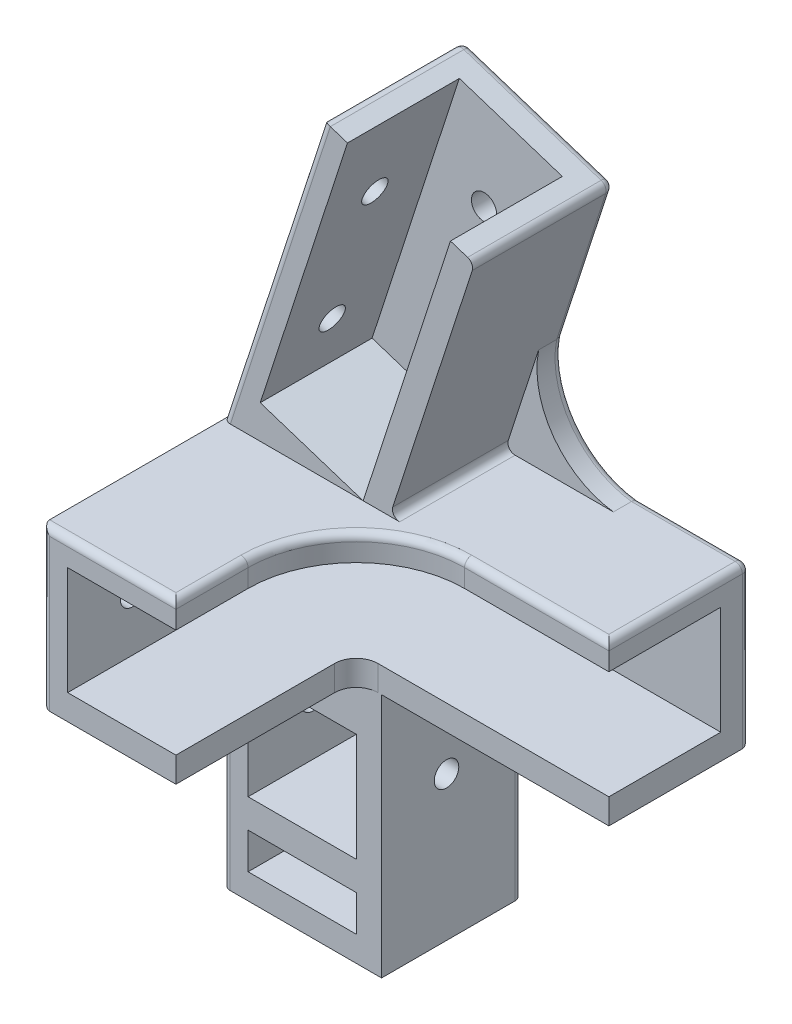
from build123d import *

# Parameters (mm, degrees)
BOSS_EXTRUDE1_DEPTH  = 19.5
SKETCH3_W            = 18.5
SKETCH3_H            = 22
BOSS_EXTRUDE2_DEPTH  = 25
SKETCH5_W            = 50
SKETCH5_H            = 15
SKETCH5_W_2          = 15
SKETCH5_H_2          = 5
CUT_EXTRUDE1_DEPTH   = 40.5
BOSS_EXTRUDE4_DEPTH  = 3.5
BOSS_EXTRUDE5_DEPTH  = 3.5
BOSS_EXTRUDE6_DEPTH  = 3.5
FILLET3_R            = 3
CUT_EXTRUDE3_DEPTH   = 1
SKETCH12_R           = 1.7
CUT_EXTRUDE4_DEPTH   = 5
SKETCH13_R           = 1.7
CUT_EXTRUDE5_DEPTH   = 45
SKETCH14_R           = 1.7
CUT_EXTRUDE6_DEPTH   = 45
SKETCH15_R           = 1.7
CUT_EXTRUDE7_DEPTH   = 4
FILLET3_OF_MIRROR2_R = 3
SKETCH16_W           = 70.294928241
SKETCH16_H           = 57.866283398
CUT_EXTRUDE8_DEPTH   = 72
BOSS_EXTRUDE7_DEPTH  = 19.5
CUT_EXTRUDE10_DEPTH  = 15.5
BOSS_EXTRUDE8_DEPTH  = 3.5
FILLET4_R            = 1
FILLET5_R            = 1
SKETCH24_R           = 1.75
CUT_EXTRUDE11_DEPTH  = 10
SKETCH25_R           = 1.75
CUT_EXTRUDE12_DEPTH  = 10


with BuildPart() as part:
    # Sketch1 → Boss-Extrude1 (new body)
    with BuildSketch(Plane.XY):
        Polygon((-5.699410772, 32.916253451), (16.300589228, 32.916253451), (16.300589228, -23.083746549), (-5.699410772, -23.083746549), (-5.699410772, 10.916253451), (-37.199410772, 10.916253451), (-37.199410772, 32.916253451), align=None)
    boss_extrude1 = extrude(amount=BOSS_EXTRUDE1_DEPTH)

    # Sketch3 → Boss-Extrude2 (add)
    with BuildSketch(Plane.XY.offset(19.5)):
        with Locations((7.050589228, 21.916253451)):
            Rectangle(SKETCH3_W, SKETCH3_H)
    boss_extrude2 = extrude(amount=BOSS_EXTRUDE2_DEPTH)

    # Sketch5 → Cut-Extrude1 (cut)
    with BuildSketch(Plane.XY.offset(44.5)):
        with Locations((-12.199410772, 21.916253451)):
            Rectangle(SKETCH5_W, SKETCH5_H)
        with Locations((5.300589228, -3.083746549)):
            Rectangle(SKETCH5_W_2, SKETCH5_H)
        with Locations((5.300589228, -17.083746549)):
            Rectangle(SKETCH5_W_2, SKETCH5_H_2)
    cut_extrude1 = extrude(amount=-CUT_EXTRUDE1_DEPTH, mode=Mode.SUBTRACT)

    # Sketch7 → Boss-Extrude4 (add)
    with BuildSketch(Plane(origin=(16.300589228, 0, 0), x_dir=(0, 0, -1), z_dir=(1, 0, 0))):
        with BuildLine():
            Line((-34.5, 10.916253451), (-19.5, 10.916253451))
            Line((-19.5, 10.916253451), (-19.5, -4.083746549))
            ThreePointArc((-19.5, -4.083746549), (-23.893398282, 6.522855169), (-34.5, 10.916253451))
        make_face()
    boss_extrude4 = extrude(amount=-BOSS_EXTRUDE4_DEPTH)

    # Sketch8 → Boss-Extrude5 (add)
    with BuildSketch(Plane(origin=(0, 0, 0), x_dir=(-1, 0, 0), z_dir=(0, 0, -1))):
        with BuildLine():
            Line((5.699410772, 10.916253451), (20.699410772, 10.916253451))
            ThreePointArc((20.699410772, 10.916253451), (10.092809055, 6.522855169), (5.699410772, -4.083746549))
            Line((5.699410772, -4.083746549), (5.699410772, 10.916253451))
        make_face()
    boss_extrude5 = extrude(amount=-BOSS_EXTRUDE5_DEPTH)

    # Sketch9 → Boss-Extrude6 (add)
    with BuildSketch(Plane(origin=(0, 32.916253451, 0), x_dir=(1, 0, 0), z_dir=(0, 1, 0))):
        with BuildLine():
            Line((-2.199410772, -34.5), (-2.199410772, -19.5))
            Line((-2.199410772, -19.5), (-17.199410772, -19.5))
            ThreePointArc((-17.199410772, -19.5), (-6.592809055, -23.893398282), (-2.199410772, -34.5))
        make_face()
    boss_extrude6 = extrude(amount=-BOSS_EXTRUDE6_DEPTH)

    # Fillet3
    fillet3_edges = [part.edges().sort_by_distance(p)[0] for p in [
        (-2.199410772, 12.666253451, 19.5),
    ]]
    fillet(fillet3_edges, radius=FILLET3_R)

    # Sketch11 → Cut-Extrude3 (cut)
    # profile 1 of 4: a face of its own
    with BuildSketch(Plane(origin=(0, 0, 0), x_dir=(-1, 0, 0), z_dir=(0, 0, -1))):
        Polygon((-10.800589228, -18.789996549), (-10.800589228, -16.838073472), (-2.43039692, -14.652977318), (-10.800589228, -12.463073472), (-10.800589228, -10.515958087), (1.199410772, -8.729900395), (1.199410772, -10.602496549), (-6.379916151, -11.729900395), (1.199410772, -13.715477318), (1.199410772, -15.597688857), (-6.379916151, -17.576054241), (1.199410772, -18.703458087), (1.199410772, -20.576054241), align=None)
    # profile 2 of 4: a face of its own
    with BuildSketch(Plane(origin=(0, 0, 0), x_dir=(-1, 0, 0), z_dir=(0, 0, -1))):
        with BuildLine():
            Line((-10.800589228, -7.991438857), (-10.800589228, -5.952977318))
            add(Edge.make_bspline(
                [(-10.800589228, -5.952977318), (-10.800005012, -5.818337024), (-10.798881276, -5.559357226), (-10.780939362, -5.185841664), (-10.756194453, -4.841644627), (-10.717588986, -4.528141475), (-10.670910939, -4.244422827), (-10.610297955, -3.991812577), (-10.542991354, -3.767135176), (-10.432899575, -3.510089545), (-10.261344606, -3.2204116), (-9.993854575, -2.916502166), (-9.674999978, -2.642644015), (-9.298421338, -2.412342144), (-8.876833149, -2.221736808), (-8.412796045, -2.089022583), (-7.914245505, -2.00467731), (-7.569376461, -1.995936272), (-7.391935381, -1.991438857)],
                knots=[0, 0, 0, 0, 1.067446855, 2.053227611, 2.964447842, 3.802928181, 4.55705831, 5.242813606, 5.861740442, 6.41401137, 7.456762865, 8.515266784, 9.610284097, 10.777391769, 12.003071174, 13.267653188, 14.594160368, 16, 16, 16, 16], degree=3))
            add(Edge.make_bspline(
                [(-7.391935381, -1.991438857), (-7.297355032, -1.992855248), (-7.111944506, -1.99563187), (-6.839545611, -2.016474255), (-6.57922187, -2.056818659), (-6.329385024, -2.104637483), (-6.092864844, -2.173393793), (-5.86736032, -2.254741183), (-5.654862929, -2.353204183), (-5.453365078, -2.465039747), (-5.262464902, -2.588608019), (-5.086843378, -2.732896484), (-4.9205107, -2.888692529), (-4.766123648, -3.059365613), (-4.626046251, -3.246963608), (-4.496602326, -3.448494847), (-4.377999142, -3.665222723), (-4.310704173, -3.817832702), (-4.276550766, -3.895285011)],
                knots=[0, 0, 0, 0, 1.163181294, 2.28024169, 3.356120165, 4.401649984, 5.406013808, 6.381787017, 7.347406326, 8.282525473, 9.21452408, 10.139462981, 11.073595085, 12.01554303, 12.965498088, 13.949545959, 14.959357709, 16, 16, 16, 16], degree=3))
            Line((-4.276550766, -3.895285011), (1.199410772, -1.452977318))
            Line((1.199410772, -1.452977318), (1.199410772, -3.541919626))
            Line((1.199410772, -3.541919626), (-4.031358458, -5.873650395))
            Line((-4.031358458, -5.873650395), (-4.031358458, -6.145285011))
            Line((-4.031358458, -6.145285011), (1.199410772, -6.145285011))
            Line((1.199410772, -6.145285011), (1.199410772, -7.991438857))
            Line((1.199410772, -7.991438857), (-10.800589228, -7.991438857))
        make_face()
        with BuildLine():
            Line((-6.185204612, -6.145285011), (-6.185204612, -5.515477318))
            add(Edge.make_bspline(
                [(-6.185204612, -5.515477318), (-6.186367141, -5.438550003), (-6.188596807, -5.291007573), (-6.198784481, -5.078941418), (-6.223636793, -4.886497292), (-6.255016899, -4.712471663), (-6.291026717, -4.555276318), (-6.342625913, -4.418389599), (-6.399049431, -4.298462814), (-6.489896288, -4.166118437), (-6.633796999, -4.027471922), (-6.856716063, -3.91397639), (-7.124487444, -3.84724369), (-7.317795964, -3.840947182), (-7.420781535, -3.837592703)],
                knots=[0, 0, 0, 0, 1.14443165, 2.194958024, 3.155864406, 4.02787753, 4.825710302, 5.549708663, 6.200008757, 6.791751392, 7.929772656, 9.129352395, 10.470655706, 12, 12, 12, 12], degree=3))
            add(Edge.make_bspline(
                [(-7.420781535, -3.837592703), (-7.484265153, -3.839856392), (-7.607360624, -3.844245712), (-7.785755229, -3.879686188), (-7.952879051, -3.933201989), (-8.103735349, -4.014031264), (-8.239800846, -4.109799367), (-8.356212547, -4.223260262), (-8.450592564, -4.353040951), (-8.531146795, -4.502587927), (-8.586059735, -4.694350085), (-8.620716321, -4.939833657), (-8.644326337, -5.246603017), (-8.645891807, -5.472154526), (-8.646743074, -5.594804241)],
                knots=[0, 0, 0, 0, 0.9241003, 1.791841178, 2.640927318, 3.471185814, 4.274581995, 5.058835706, 5.827024317, 6.605084504, 7.520888769, 8.714677486, 10.213517293, 12, 12, 12, 12], degree=3))
            Line((-8.646743074, -5.594804241), (-8.646743074, -6.145285011))
            Line((-8.646743074, -6.145285011), (-6.185204612, -6.145285011))
        make_face(mode=Mode.SUBTRACT)
    # profile 3 of 4: a face of its own
    with BuildSketch(Plane(origin=(0, 0, 0), x_dir=(-1, 0, 0), z_dir=(0, 0, -1))):
        with BuildLine():
            add(Edge.make_bspline(
                [(-1.262127689, -0.176054241), (-1.257647984, -0.104101941), (-1.248753835, 0.038754448), (-1.172545764, 0.242235867), (-1.05033496, 0.427832621), (-0.88404186, 0.590235666), (-0.687299125, 0.730105266), (-0.462023761, 0.828247267), (-0.217504351, 0.891566147), (-0.046993635, 0.897708021), (0.040756926, 0.900868836)],
                knots=[0, 0, 0, 0, 0.919349048, 1.825304879, 2.744940427, 3.746623331, 4.786044724, 5.819977252, 6.878086821, 8, 8, 8, 8], degree=3))
            add(Edge.make_bspline(
                [(0.040756926, 0.900868836), (0.128481887, 0.897613897), (0.299721778, 0.891260229), (0.545324854, 0.828809783), (0.771582895, 0.729449747), (0.970335119, 0.590396057), (1.138671939, 0.427821465), (1.264004419, 0.242957175), (1.339760461, 0.038678283), (1.348736151, -0.104127453), (1.353256926, -0.176054241)],
                knots=[0, 0, 0, 0, 1.117536417, 2.181440851, 3.211339843, 4.255104211, 5.260135653, 6.181815925, 7.084237479, 8, 8, 8, 8], degree=3))
            add(Edge.make_bspline(
                [(1.353256926, -0.176054241), (1.348770157, -0.248001687), (1.339861983, -0.390848436), (1.263364391, -0.595455675), (1.139460356, -0.781986068), (0.970956709, -0.945114294), (0.77080448, -1.081189928), (0.54542444, -1.181069939), (0.299695058, -1.243328016), (0.128472836, -1.249708594), (0.040756926, -1.252977318)],
                knots=[0, 0, 0, 0, 0.915447906, 1.817559426, 2.747445231, 3.752131388, 4.789763433, 5.819308596, 6.882847519, 8, 8, 8, 8], degree=3))
            add(Edge.make_bspline(
                [(0.040756926, -1.252977318), (-0.046984438, -1.249802679), (-0.217477284, -1.243633944), (-0.462123928, -1.180506316), (-0.686511891, -1.081845741), (-0.884668075, -0.944947749), (-1.051117925, -0.781983335), (-1.171904853, -0.594743665), (-1.248854997, -0.390923093), (-1.257681869, -0.248026694), (-1.262127689, -0.176054241)],
                knots=[0, 0, 0, 0, 1.121525552, 2.179269538, 3.212844836, 4.246063491, 5.247400307, 6.175325774, 7.080968592, 8, 8, 8, 8], degree=3))
        make_face()
    # profile 4 of 4: a face of its own
    with BuildSketch(Plane(origin=(0, 0, 0), x_dir=(-1, 0, 0), z_dir=(0, 0, -1))):
        with BuildLine():
            Line((-7.877512305, 3.639330374), (-7.877512305, 1.793176528))
            add(Edge.make_bspline(
                [(-7.877512305, 1.793176528), (-7.985104597, 1.806156245), (-8.194919789, 1.831467926), (-8.50062502, 1.89307865), (-8.789725475, 1.969009097), (-9.063857289, 2.060670567), (-9.32041803, 2.168002956), (-9.560895844, 2.292709709), (-9.787587098, 2.42930416), (-9.925017131, 2.537709574), (-9.99289692, 2.591253451)],
                knots=[0, 0, 0, 0, 1.13409845, 2.211599726, 3.261451197, 4.261463951, 5.235132031, 6.169264622, 7.095758548, 8, 8, 8, 8], degree=3))
            add(Edge.make_bspline(
                [(-9.99289692, 2.591253451), (-10.082013161, 2.667910273), (-10.256359415, 2.817881026), (-10.483761061, 3.07110519), (-10.676767562, 3.337669411), (-10.835123876, 3.619879277), (-10.958228421, 3.915924445), (-11.044683072, 4.227572925), (-11.099664631, 4.553240287), (-11.10537913, 4.776126179), (-11.108281535, 4.889330374)],
                knots=[0, 0, 0, 0, 1.065406432, 2.084352066, 3.078868942, 4.045367136, 5.013203651, 5.979674514, 6.9738726, 8, 8, 8, 8], degree=3))
            add(Edge.make_bspline(
                [(-11.108281535, 4.889330374), (-11.105554752, 4.990429502), (-11.100204953, 5.188780494), (-11.056686246, 5.480236578), (-10.97985421, 5.757907044), (-10.8818086, 6.026068289), (-10.745230943, 6.277428113), (-10.587175591, 6.520140361), (-10.396186865, 6.748620977), (-10.177194209, 6.959885993), (-9.943110555, 7.156839202), (-9.690759412, 7.324416021), (-9.43059281, 7.47074821), (-9.157422302, 7.588703888), (-8.873189212, 7.680392593), (-8.578388089, 7.744054748), (-8.273858918, 7.787935844), (-8.06677444, 7.791411893), (-7.96164692, 7.793176528)],
                knots=[0, 0, 0, 0, 1.018635126, 1.998506719, 2.96030997, 3.918683232, 4.868719089, 5.836268132, 6.834011598, 7.861887245, 8.899958098, 9.91230014, 10.909978245, 11.904579616, 12.905650751, 13.91466998, 14.941371293, 16, 16, 16, 16], degree=3))
            add(Edge.make_bspline(
                [(-7.96164692, 7.793176528), (-7.831571704, 7.7882504), (-7.575267724, 7.778543815), (-7.199658116, 7.710806724), (-6.842854452, 7.593710225), (-6.50564623, 7.43251906), (-6.191993909, 7.228071619), (-5.907939838, 6.979968911), (-5.654954295, 6.689672154), (-5.517272776, 6.469896674), (-5.447223843, 6.358080374)],
                knots=[0, 0, 0, 0, 1.027701034, 2.025011931, 3.004147813, 3.986880317, 4.970346872, 5.953160964, 6.958619193, 8, 8, 8, 8], degree=3))
            add(Edge.make_bspline(
                [(-5.447223843, 6.358080374), (-5.418934484, 6.430798423), (-5.362819656, 6.575042087), (-5.255412748, 6.779194324), (-5.134751997, 6.973329501), (-4.999067172, 7.154540458), (-4.847347238, 7.322970358), (-4.681616094, 7.478791827), (-4.500395305, 7.624150933), (-4.30375287, 7.755244697), (-4.095176448, 7.873355347), (-3.875726079, 7.97347104), (-3.648685489, 8.060719415), (-3.412791492, 8.133216192), (-3.166864793, 8.188590605), (-2.911254324, 8.225884056), (-2.647259211, 8.251365722), (-2.468118928, 8.253589988), (-2.377512305, 8.254714989)],
                knots=[0, 0, 0, 0, 0.971157749, 1.926390409, 2.867917292, 3.816032967, 4.741824403, 5.6878893, 6.646452846, 7.631864642, 8.628382992, 9.628642509, 10.633224323, 11.656081692, 12.699617594, 13.76949873, 14.871843985, 16, 16, 16, 16], degree=3))
            add(Edge.make_bspline(
                [(-2.377512305, 8.254714989), (-2.244325252, 8.252503818), (-1.981850533, 8.248146212), (-1.597044081, 8.197009582), (-1.226862615, 8.122689872), (-0.874542963, 8.009706698), (-0.536107314, 7.870492658), (-0.212201339, 7.699845341), (0.092892066, 7.493753909), (0.380575775, 7.261849568), (0.643411265, 7.006428676), (0.8765742, 6.732895346), (1.069672671, 6.437585756), (1.23223783, 6.128720843), (1.355158488, 5.799574581), (1.443839147, 5.455657192), (1.498563993, 5.093806224), (1.504216675, 4.847057422), (1.50710308, 4.721061143)],
                knots=[0, 0, 0, 0, 1.08934669, 2.146800001, 3.171892192, 4.175766193, 5.1695646, 6.164076811, 7.166278581, 8.178196077, 9.184573215, 10.16196427, 11.113242845, 12.066531174, 13.012937118, 13.981620827, 14.969363733, 16, 16, 16, 16], degree=3))
            add(Edge.make_bspline(
                [(1.50710308, 4.721061143), (1.504031919, 4.602279119), (1.498005885, 4.36921268), (1.44571629, 4.02762683), (1.362713421, 3.702437153), (1.243881772, 3.394298005), (1.091092441, 3.104692046), (0.906771997, 2.829859086), (0.687442467, 2.57259779), (0.434322499, 2.3350891), (0.15282569, 2.119255522), (-0.153407037, 1.926340908), (-0.483775783, 1.75924538), (-0.840338868, 1.624378739), (-1.217591782, 1.506817115), (-1.621739126, 1.421885121), (-2.049128635, 1.361769677), (-2.342880764, 1.341824077), (-2.49289692, 1.331638066)],
                knots=[0, 0, 0, 0, 0.974003266, 1.911126485, 2.827923683, 3.722775623, 4.613731572, 5.50894563, 6.432318302, 7.38099101, 8.351349308, 9.338047726, 10.346428225, 11.382873954, 12.462111462, 13.585146545, 14.766759469, 16, 16, 16, 16], degree=3))
            Line((-2.49289692, 1.331638066), (-2.49289692, 3.177791913))
            add(Edge.make_bspline(
                [(-2.49289692, 3.177791913), (-2.417425318, 3.188945376), (-2.270574462, 3.210647521), (-2.058705359, 3.256683558), (-1.861732034, 3.311165199), (-1.680044741, 3.376135049), (-1.514279405, 3.45120486), (-1.360798784, 3.532148117), (-1.223710633, 3.625749249), (-1.065384613, 3.762941693), (-0.896220111, 3.953356149), (-0.749458771, 4.217045491), (-0.662515335, 4.51137642), (-0.652102457, 4.7164657), (-0.646743074, 4.822022682)],
                knots=[0, 0, 0, 0, 1.004083628, 1.953722164, 2.852062002, 3.692886634, 4.490800013, 5.245942238, 5.974461452, 6.670088602, 8.000762069, 9.303976857, 10.612389357, 12, 12, 12, 12], degree=3))
            add(Edge.make_bspline(
                [(-0.646743074, 4.822022682), (-0.647864371, 4.878202331), (-0.650053976, 4.987906785), (-0.675076379, 5.149181645), (-0.716357012, 5.302683497), (-0.770574005, 5.45033855), (-0.844338553, 5.58810378), (-0.931901508, 5.719433893), (-1.034609515, 5.844770146), (-1.195110626, 5.995917646), (-1.416786421, 6.163242766), (-1.719322479, 6.30573827), (-2.050588673, 6.3928176), (-2.280814454, 6.403216349), (-2.39914692, 6.408561143)],
                knots=[0, 0, 0, 0, 0.766703657, 1.497175717, 2.221804895, 2.935192376, 3.640052165, 4.350243223, 5.088623085, 5.847082799, 7.357237736, 8.859920549, 10.386048059, 12, 12, 12, 12], degree=3))
            add(Edge.make_bspline(
                [(-2.39914692, 6.408561143), (-2.464945748, 6.406711942), (-2.594787133, 6.403062896), (-2.786195597, 6.374088866), (-2.969648465, 6.322755274), (-3.145763747, 6.253440485), (-3.312932079, 6.163011753), (-3.473227413, 6.054384045), (-3.62413007, 5.923172242), (-3.768170684, 5.775714059), (-3.898710135, 5.608114668), (-4.014720541, 5.423570124), (-4.109640596, 5.219059789), (-4.193220285, 4.999736952), (-4.254214347, 4.760765565), (-4.29872396, 4.505093902), (-4.332010414, 4.232310528), (-4.336655471, 4.044084373), (-4.339050766, 3.947022682)],
                knots=[0, 0, 0, 0, 0.899536996, 1.775063972, 2.638995881, 3.499655969, 4.357521698, 5.232774386, 6.141935922, 7.087285127, 8.047315231, 9.041502366, 10.060909586, 11.125312509, 12.246833879, 13.426779274, 14.673079445, 16, 16, 16, 16], degree=3))
            Line((-4.339050766, 3.947022682), (-6.339050766, 3.947022682))
            add(Edge.make_bspline(
                [(-6.339050766, 3.947022682), (-6.351211097, 4.070597942), (-6.374042407, 4.302613426), (-6.427589871, 4.624478183), (-6.497441604, 4.896812425), (-6.588065699, 5.121571579), (-6.694964612, 5.310796304), (-6.816990742, 5.474794656), (-6.9584857, 5.616776513), (-7.116669669, 5.733391795), (-7.285211073, 5.826558536), (-7.45907096, 5.899690982), (-7.641166228, 5.937102036), (-7.763594277, 5.943722311), (-7.824627689, 5.947022682)],
                knots=[0, 0, 0, 0, 1.613490305, 3.029366345, 4.236845818, 5.259854129, 6.169213254, 7.054399038, 7.908596932, 8.76463379, 9.599115534, 10.407455461, 11.206077139, 12, 12, 12, 12], degree=3))
            add(Edge.make_bspline(
                [(-7.824627689, 5.947022682), (-7.902708499, 5.94339984), (-8.054533682, 5.93635536), (-8.271474473, 5.879601033), (-8.4685132, 5.787571995), (-8.638517306, 5.657006158), (-8.780104567, 5.497937744), (-8.882578523, 5.311699797), (-8.945232074, 5.101614866), (-8.951293618, 4.953882443), (-8.954435381, 4.877311143)],
                knots=[0, 0, 0, 0, 1.073009827, 2.08642706, 3.062829201, 4.046239177, 5.014892964, 5.972187552, 6.948963055, 8, 8, 8, 8], degree=3))
            add(Edge.make_bspline(
                [(-8.954435381, 4.877311143), (-8.95071032, 4.808009077), (-8.94335375, 4.671145417), (-8.884755184, 4.47123759), (-8.789639268, 4.281474968), (-8.656940841, 4.105904867), (-8.497545942, 3.947245812), (-8.310497414, 3.816432348), (-8.104113715, 3.708690565), (-7.953735758, 3.662661532), (-7.877512305, 3.639330374)],
                knots=[0, 0, 0, 0, 0.942455657, 1.861242209, 2.81281304, 3.818879151, 4.845099048, 5.862404497, 6.916497371, 8, 8, 8, 8], degree=3))
        make_face()
    extrude(amount=-CUT_EXTRUDE3_DEPTH, mode=Mode.SUBTRACT)

    # Sketch12 → Cut-Extrude4 (cut)
    with BuildSketch(Plane(origin=(0, 0, 0), x_dir=(-1, 0, 0), z_dir=(0, 0, -1))):
        with Locations((-5.300589228, 21.916253451)):
            Circle(SKETCH12_R)
        with Locations((10.949410772, 21.916253451)):
            Circle(SKETCH12_R)
        with Locations((27.199410772, 21.916253451)):
            Circle(SKETCH12_R)
    cut_extrude4 = extrude(amount=-CUT_EXTRUDE4_DEPTH, mode=Mode.SUBTRACT)

    # Sketch13 → Cut-Extrude5 (cut)
    with BuildSketch(Plane.ZY.offset(5.699410772)):
        with Locations(Location((10.5, -3.083746549, 0), (0, 0, 270))):
            Circle(SKETCH13_R)
    cut_extrude5 = extrude(amount=-CUT_EXTRUDE5_DEPTH, mode=Mode.SUBTRACT)

    # Sketch14 → Cut-Extrude6 (cut)
    with BuildSketch(Plane(origin=(16.300589228, 0, 0), x_dir=(0, 0, -1), z_dir=(1, 0, 0))):
        with Locations(Location((-10.5, 21.916253451, 0), (0, 0, 90))):
            Circle(SKETCH14_R)
        with Locations(Location((-35.5, 21.916253451, 0), (0, 0, 90))):
            Circle(SKETCH14_R)
    cut_extrude6 = extrude(amount=-CUT_EXTRUDE6_DEPTH, mode=Mode.SUBTRACT)

    # Sketch15 → Cut-Extrude7 (cut)
    with BuildSketch(Plane.XZ.offset(23.083746549)):
        with Locations(Location((5.300589228, 9.75, 0), (0, 0, 270))):
            Circle(SKETCH15_R)
    cut_extrude7 = extrude(amount=-CUT_EXTRUDE7_DEPTH, mode=Mode.SUBTRACT)

    # Mirror2: Boss-Extrude1, Boss-Extrude2, Cut-Extrude1, Boss-Extrude4, Boss-Extrude5, Boss-Extrude6, Cut-Extrude4, Cut-Extrude5, Cut-Extrude6, Cut-Extrude7 across plane
    add(boss_extrude1.mirror(Plane(origin=(16.300589228, 32.916253451, 19.5), x_dir=(0, 0, 1), z_dir=(-1, 0, 0))))
    add(boss_extrude2.mirror(Plane(origin=(16.300589228, 32.916253451, 19.5), x_dir=(0, 0, 1), z_dir=(-1, 0, 0))))
    add(cut_extrude1.mirror(Plane(origin=(16.300589228, 32.916253451, 19.5), x_dir=(0, 0, 1), z_dir=(-1, 0, 0))), mode=Mode.SUBTRACT)
    add(boss_extrude4.mirror(Plane(origin=(16.300589228, 32.916253451, 19.5), x_dir=(0, 0, 1), z_dir=(-1, 0, 0))))
    add(boss_extrude5.mirror(Plane(origin=(16.300589228, 32.916253451, 19.5), x_dir=(0, 0, 1), z_dir=(-1, 0, 0))))
    add(boss_extrude6.mirror(Plane(origin=(16.300589228, 32.916253451, 19.5), x_dir=(0, 0, 1), z_dir=(-1, 0, 0))))
    add(cut_extrude4.mirror(Plane(origin=(16.300589228, 32.916253451, 19.5), x_dir=(0, 0, 1), z_dir=(-1, 0, 0))), mode=Mode.SUBTRACT)
    add(cut_extrude5.mirror(Plane(origin=(16.300589228, 32.916253451, 19.5), x_dir=(0, 0, 1), z_dir=(-1, 0, 0))), mode=Mode.SUBTRACT)
    add(cut_extrude6.mirror(Plane(origin=(16.300589228, 32.916253451, 19.5), x_dir=(0, 0, 1), z_dir=(-1, 0, 0))), mode=Mode.SUBTRACT)
    add(cut_extrude7.mirror(Plane(origin=(16.300589228, 32.916253451, 19.5), x_dir=(0, 0, 1), z_dir=(-1, 0, 0))), mode=Mode.SUBTRACT)

    # Fillet3 of Mirror2
    fillet3_of_mirror2_edges = [part.edges().sort_by_distance(p)[0] for p in [
        (34.800589228, 12.666253451, 19.5),
    ]]
    fillet(fillet3_of_mirror2_edges, radius=FILLET3_OF_MIRROR2_R)

    # Sketch16 → Cut-Extrude8 (cut)
    with BuildSketch(Plane(origin=(0, 0, 0), x_dir=(-1, 0, 0), z_dir=(0, 0, -1))):
        with Locations((18.846874893, 3.983111752)):
            Rectangle(SKETCH16_W, SKETCH16_H)
    extrude(amount=-CUT_EXTRUDE8_DEPTH, mode=Mode.SUBTRACT)

    # Sketch21 → Boss-Extrude7 (add)
    with BuildSketch(Plane(origin=(0, 0, 0), x_dir=(-1, 0, 0), z_dir=(0, 0, -1))):
        Polygon((-16.300589228, 32.916253451), (-30.252160589, 75.854774946), (-51.175403947, 69.05640107), (-39.432758161, 32.916253451), align=None)
    extrude(amount=-BOSS_EXTRUDE7_DEPTH)

    # Sketch22 → Cut-Extrude10 (cut)
    with BuildSketch(Plane.XY.offset(19.5)):
        Polygon((33.580858396, 74.773215466), (21.486792632, 37.551508367), (35.752640376, 32.916253451), (47.84670614, 70.137960551), align=None)
    extrude(amount=-CUT_EXTRUDE10_DEPTH, mode=Mode.SUBTRACT)

    # Sketch23 → Boss-Extrude8 (add)
    with BuildSketch(Plane(origin=(0, 0, 0), x_dir=(-1, 0, 0), z_dir=(0, 0, -1))):
        with BuildLine():
            Line((-54.432758161, 32.916253451), (-39.432758161, 32.916253451))
            Line((-39.432758161, 32.916253451), (-44.068013076, 47.182101195))
            ThreePointArc((-44.068013076, 47.182101195), (-46.127819137, 37.780499977), (-54.432758161, 32.916253451))
        make_face()
    extrude(amount=-BOSS_EXTRUDE8_DEPTH)

    # Fillet4
    fillet4_edges = [part.edges().sort_by_distance(p)[0] for p in [
        (16.300589228, 10.916253451, 39.5),
        (16.300589228, 6.522855169, 23.893398282),
        (61.550589228, 10.916253451, 0),
        (42.69398751, 6.522855169, 0),
        (59.800589228, 32.916253451, 19.5),
        (34.800589228, 32.916253451, 39.5),
        (23.276374908, 54.385514199, 19.5),
        (47.621708512, 58.119251133, 0),
        (62.116673694, 32.916253451, 0),
        (46.127819137, 37.780499977, 0),
        (23.276374908, 54.385514199, 0),
        (16.300589228, -13.583746549, 19.5),
        (16.300589228, 4.916253451, 0),
        (38.300589228, -13.583746549, 0),
        (69.800589228, 32.916253451, 9.75),
        (69.800589228, 21.916253451, 0),
        (16.300589228, 21.916253451, 44.5),
        (39.19398751, 32.916253451, 23.893398282),
        (25.550589228, 32.916253451, 44.5),
        (30.252160589, 75.854774946, 9.75),
        (40.713782268, 72.455588008, 0),
        (51.175403947, 69.05640107, 9.75),
    ]]
    fillet(fillet4_edges, radius=FILLET4_R)

    # Fillet5
    fillet5_edges = [part.edges().sort_by_distance(p)[0] for p in [
        (39.432758161, 32.916253451, 11.5),
    ]]
    fillet(fillet5_edges, radius=FILLET5_R)

    # Sketch24 → Cut-Extrude11 (cut)
    with BuildSketch(Plane(origin=(5.070177296, -1.647400467, 0), x_dir=(0, 0, 1), z_dir=(-0.9510565162951522, 0.30901699437495195, 0))):
        with Locations(Location((12, 69.490609743, 0), (0, 0, 270))):
            Circle(SKETCH24_R)
        with Locations(Location((12, 50.353390807, 0), (0, 0, 270))):
            Circle(SKETCH24_R)
    extrude(amount=-CUT_EXTRUDE11_DEPTH, mode=Mode.SUBTRACT)

    # Sketch25 → Cut-Extrude12 (cut)
    with BuildSketch(Plane(origin=(0, 0, 0), x_dir=(-1, 0, 0), z_dir=(0, 0, -1))):
        with Locations((-37.005578335, 61.042909813)):
            Circle(SKETCH25_R)
        with Locations((-31.01459821, 42.60456891)):
            Circle(SKETCH25_R)
    extrude(amount=-CUT_EXTRUDE12_DEPTH, mode=Mode.SUBTRACT)


solid = part.part
